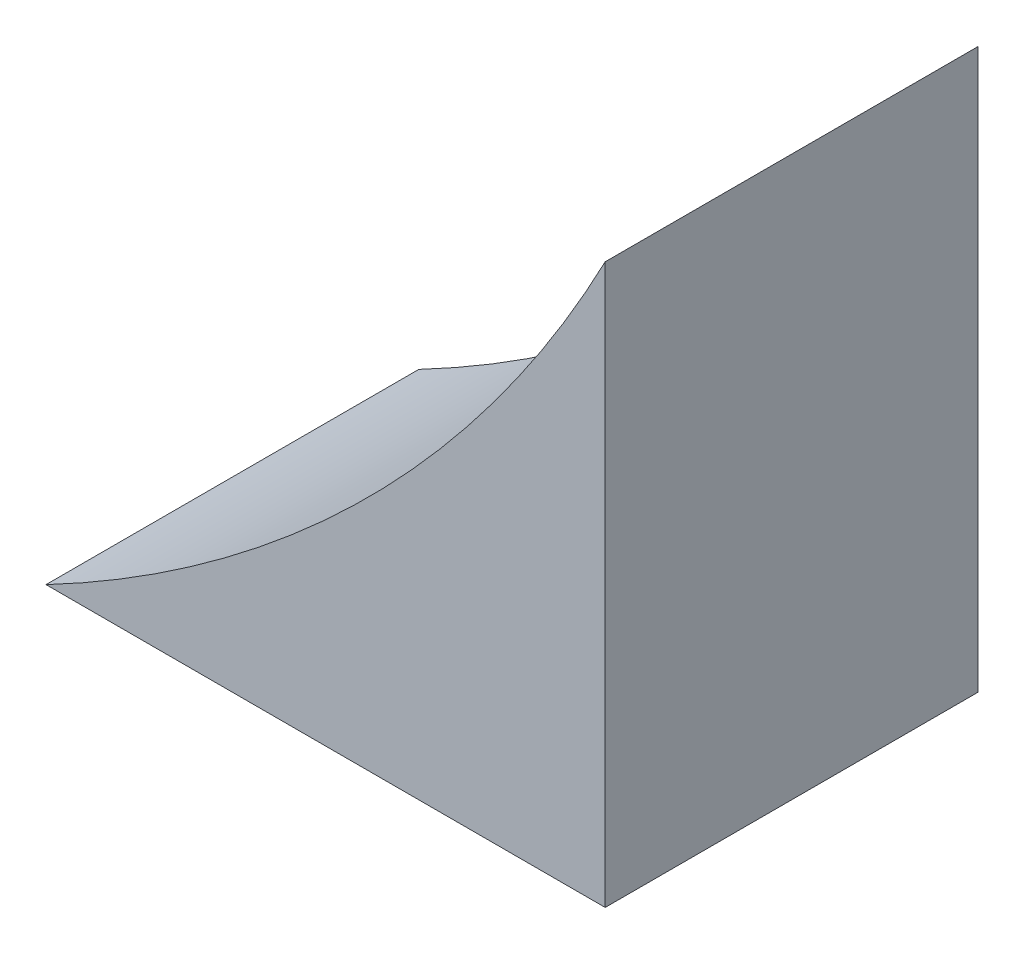
from build123d import *

# Parameters (mm, degrees)
SKETCH_1_W          = 150
SKETCH_1_H          = 150
EXTRUDE_1_DEPTH     = 100
SKETCH_2_R          = 355
CUT_EXTRUDE_1_DEPTH = 1000


with BuildPart() as part:
    # 草图1 → 凸台-拉伸1 (new body)
    with BuildSketch(Plane.XY):
        with Locations((75, 75)):
            Rectangle(SKETCH_1_W, SKETCH_1_H)
    extrude(amount=EXTRUDE_1_DEPTH)

    # 草图2 → 切除-拉伸1 (cut)
    with BuildSketch(Plane.XY.offset(100)):
        with Locations((-164.556882598, 314.556882598)):
            Circle(SKETCH_2_R)
    extrude(amount=-CUT_EXTRUDE_1_DEPTH, mode=Mode.SUBTRACT)


solid = part.part
